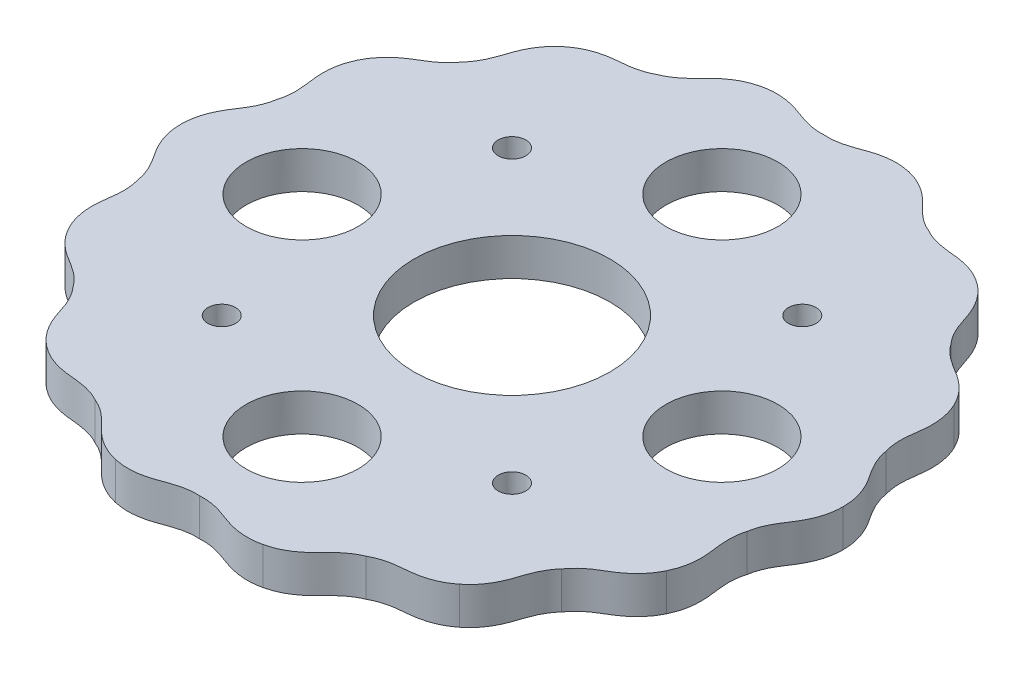
from build123d import *

# Parameters (mm, degrees)
BOSS_EXTRUDE3_DEPTH = 4
SKETCH2_R           = 6
SKETCH2_R_2         = 10.5
CUT_EXTRUDE1_DEPTH  = 5
SKETCH2_4_R         = 1.48
CUT_EXTRUDE2_DEPTH  = 2.22


with BuildPart() as part:
    # Sketch1 → Boss-Extrude3 (new body)
    with BuildSketch(Plane(origin=(0, 0, 0), x_dir=(1, 0, 0), z_dir=(0, 1, 0))):
        with BuildLine():
            Line((35.500002326, 0.003735881), (35.500002326, 0))
            Line((35.500002326, 0), (35.500002326, -0.003735881))
            add(Edge.make_bspline(
                [(32.644810899, -7.45096506), (32.674793712, -7.260710929), (32.757965618, -6.873262555), (32.975088878, -6.197475635), (33.30681421, -5.487322542), (33.693887271, -4.83935734), (34.139372051, -4.165162167), (34.499748971, -3.6014921), (34.870711868, -2.889611748), (35.149566879, -2.192738575), (35.418263863, -1.23361479), (35.50061524, -0.495919336), (35.500002326, -0.003735881)],
                knots=[0.02301065, 0.02301065, 0.02301065, 0.02301065, 0.053541567, 0.084072485, 0.145134319, 0.206196153, 0.267257988, 0.389381656, 0.511505325, 0.633628994, 0.755752663, 1, 1, 1, 1], degree=3))
            add(Edge.make_bspline(
                [(31.986017844, -15.399507835), (32.200120458, -14.956331799), (32.445998494, -14.255960238), (32.62005909, -13.275236314), (32.671181344, -12.526384626), (32.645828632, -11.724047822), (32.565707523, -11.059836954), (32.456861927, -10.25911949), (32.389262714, -9.507378309), (32.398512397, -8.723622254), (32.496104055, -8.020553026), (32.589276306, -7.635387164), (32.644810899, -7.45096506)],
                knots=[0.02301065, 0.02301065, 0.02301065, 0.02301065, 0.267257988, 0.389381656, 0.511505325, 0.633628994, 0.755752663, 0.816814497, 0.877876331, 0.938938166, 0.969469083, 1, 1, 1, 1], degree=3))
            Line((31.986017844, -15.399507835), (31.984396906, -15.402873748))
            Line((31.984396906, -15.402873748), (31.982775968, -15.406239661))
            add(Edge.make_bspline(
                [(26.179105738, -20.877140171), (26.288667493, -20.718736177), (26.531710341, -20.405744191), (27.020544594, -19.891087467), (27.62754267, -19.395191866), (28.257425012, -18.979340099), (28.951315253, -18.565199839), (29.520570914, -18.213712342), (30.163670245, -17.733285076), (30.717271866, -17.226414698), (31.375507699, -16.478857279), (31.769777787, -15.849947564), (31.982775968, -15.406239661)],
                knots=[0.02301065, 0.02301065, 0.02301065, 0.02301065, 0.053541567, 0.084072485, 0.145134319, 0.206196153, 0.267257988, 0.389381656, 0.511505325, 0.633628994, 0.755752663, 1, 1, 1, 1], degree=3))
            add(Edge.make_bspline(
                [(22.136810246, -27.752690162), (22.521996911, -27.446297993), (23.047405198, -26.921967502), (23.62974854, -26.113887841), (24.00072267, -25.461376898), (24.326001557, -24.727496287), (24.542005228, -24.094299727), (24.791357022, -23.325651886), (25.05662051, -22.619026286), (25.405013194, -21.916899767), (25.797990545, -21.325799714), (26.049053047, -21.019203188), (26.179105738, -20.877140171)],
                knots=[0.02301065, 0.02301065, 0.02301065, 0.02301065, 0.267257988, 0.389381656, 0.511505325, 0.633628994, 0.755752663, 0.816814497, 0.877876331, 0.938938166, 0.969469083, 1, 1, 1, 1], degree=3))
            Line((22.136810246, -27.752690162), (22.133889416, -27.755019446))
            Line((22.133889416, -27.755019446), (22.130968587, -27.75734873))
            add(Edge.make_bspline(
                [(14.52830762, -30.168341629), (14.695748267, -30.073161626), (15.05052444, -29.89661793), (15.714250068, -29.645025478), (16.476297475, -29.461605575), (17.224233175, -29.360231784), (18.029095404, -29.288171996), (18.694481743, -29.218483478), (19.482343797, -29.064663811), (20.201044438, -28.848188121), (21.118447439, -28.460259983), (21.746546212, -28.06469929), (22.130968587, -27.75734873)],
                knots=[0.02301065, 0.02301065, 0.02301065, 0.02301065, 0.053541567, 0.084072485, 0.145134319, 0.206196153, 0.267257988, 0.389381656, 0.511505325, 0.633628994, 0.755752663, 1, 1, 1, 1], degree=3))
            add(Edge.make_bspline(
                [(7.903135888, -34.609111839), (8.383115662, -34.500188263), (9.083990645, -34.255748926), (9.959276491, -33.780363616), (10.576626521, -33.353431213), (11.188111536, -32.833360849), (11.657457809, -32.356590942), (12.215619812, -31.772252855), (12.761207314, -31.250698702), (13.379739556, -30.769266488), (13.990268616, -30.407210225), (14.349495361, -30.239908237), (14.52830762, -30.168341629)],
                knots=[0.02301065, 0.02301065, 0.02301065, 0.02301065, 0.267257988, 0.389381656, 0.511505325, 0.633628994, 0.755752663, 0.816814497, 0.877876331, 0.938938166, 0.969469083, 1, 1, 1, 1], degree=3))
            Line((7.903135888, -34.609111839), (7.899493673, -34.60994315))
            Line((7.899493673, -34.60994315), (7.895851458, -34.610774462))
            add(Edge.make_bspline(
                [(0, -33.484333037), (0.192155866, -33.471228592), (0.588397592, -33.466099831), (1.295555593, -33.527402621), (2.061719496, -33.692786976), (2.779570716, -33.925969485), (3.535992098, -34.210262493), (4.165721189, -34.43617562), (4.942300224, -34.639429423), (5.683752409, -34.756224087), (6.678619663, -34.804759157), (7.416144457, -34.72089313), (7.895851458, -34.610774462)],
                knots=[0.02301065, 0.02301065, 0.02301065, 0.02301065, 0.053541567, 0.084072485, 0.145134319, 0.206196153, 0.267257988, 0.389381656, 0.511505325, 0.633628994, 0.755752663, 1, 1, 1, 1], degree=3))
            add(Edge.make_bspline(
                [(-7.895851458, -34.610774462), (-7.416144457, -34.72089313), (-6.678619663, -34.804759157), (-5.683752409, -34.756224087), (-4.942300224, -34.639429423), (-4.165721189, -34.43617562), (-3.535992098, -34.210262493), (-2.779570716, -33.925969485), (-2.061719496, -33.692786976), (-1.295555593, -33.527402621), (-0.588397592, -33.466099831), (-0.192155866, -33.471228592), (0, -33.484333037)],
                knots=[0.02301065, 0.02301065, 0.02301065, 0.02301065, 0.267257988, 0.389381656, 0.511505325, 0.633628994, 0.755752663, 0.816814497, 0.877876331, 0.938938166, 0.969469083, 1, 1, 1, 1], degree=3))
            Line((-7.895851458, -34.610774462), (-7.899493673, -34.60994315))
            Line((-7.899493673, -34.60994315), (-7.903135888, -34.609111839))
            add(Edge.make_bspline(
                [(-14.52830762, -30.168341629), (-14.349495361, -30.239908237), (-13.990268616, -30.407210225), (-13.379739556, -30.769266488), (-12.761207314, -31.250698702), (-12.215619812, -31.772252855), (-11.657457809, -32.356590942), (-11.188111536, -32.833360849), (-10.576626521, -33.353431213), (-9.959276491, -33.780363616), (-9.083990645, -34.255748926), (-8.383115662, -34.500188263), (-7.903135888, -34.609111839)],
                knots=[0.02301065, 0.02301065, 0.02301065, 0.02301065, 0.053541567, 0.084072485, 0.145134319, 0.206196153, 0.267257988, 0.389381656, 0.511505325, 0.633628994, 0.755752663, 1, 1, 1, 1], degree=3))
            add(Edge.make_bspline(
                [(-22.130968587, -27.75734873), (-21.746546212, -28.06469929), (-21.118447439, -28.460259983), (-20.201044438, -28.848188121), (-19.482343797, -29.064663811), (-18.694481743, -29.218483478), (-18.029095404, -29.288171996), (-17.224233175, -29.360231784), (-16.476297475, -29.461605575), (-15.714250068, -29.645025478), (-15.05052444, -29.89661793), (-14.695748267, -30.073161626), (-14.52830762, -30.168341629)],
                knots=[0.02301065, 0.02301065, 0.02301065, 0.02301065, 0.267257988, 0.389381656, 0.511505325, 0.633628994, 0.755752663, 0.816814497, 0.877876331, 0.938938166, 0.969469083, 1, 1, 1, 1], degree=3))
            Line((-22.130968587, -27.75734873), (-22.133889416, -27.755019446))
            Line((-22.133889416, -27.755019446), (-22.136810246, -27.752690162))
            add(Edge.make_bspline(
                [(-26.179105738, -20.877140171), (-26.049053047, -21.019203188), (-25.797990545, -21.325799714), (-25.405013194, -21.916899767), (-25.05662051, -22.619026286), (-24.791357022, -23.325651886), (-24.542005228, -24.094299727), (-24.326001557, -24.727496287), (-24.00072267, -25.461376898), (-23.62974854, -26.113887841), (-23.047405198, -26.921967502), (-22.521996911, -27.446297993), (-22.136810246, -27.752690162)],
                knots=[0.02301065, 0.02301065, 0.02301065, 0.02301065, 0.053541567, 0.084072485, 0.145134319, 0.206196153, 0.267257988, 0.389381656, 0.511505325, 0.633628994, 0.755752663, 1, 1, 1, 1], degree=3))
            add(Edge.make_bspline(
                [(-31.982775968, -15.406239661), (-31.769777787, -15.849947564), (-31.375507698, -16.478857279), (-30.717271866, -17.226414698), (-30.163670245, -17.733285076), (-29.520570914, -18.213712342), (-28.951315253, -18.565199839), (-28.257425012, -18.979340099), (-27.62754267, -19.395191866), (-27.020544594, -19.891087467), (-26.531710341, -20.405744191), (-26.288667493, -20.718736177), (-26.179105738, -20.877140171)],
                knots=[0.02301065, 0.02301065, 0.02301065, 0.02301065, 0.267257988, 0.389381656, 0.511505325, 0.633628994, 0.755752663, 0.816814497, 0.877876331, 0.938938166, 0.969469083, 1, 1, 1, 1], degree=3))
            Line((-31.982775968, -15.406239661), (-31.984396906, -15.402873748))
            Line((-31.984396906, -15.402873748), (-31.986017844, -15.399507835))
            add(Edge.make_bspline(
                [(-32.644810899, -7.45096506), (-32.589276306, -7.635387164), (-32.496104055, -8.020553026), (-32.398512397, -8.723622254), (-32.389262714, -9.507378309), (-32.456861927, -10.25911949), (-32.565707523, -11.059836954), (-32.645828632, -11.724047822), (-32.671181344, -12.526384626), (-32.62005909, -13.275236314), (-32.445998494, -14.255960238), (-32.200120458, -14.956331799), (-31.986017844, -15.399507835)],
                knots=[0.02301065, 0.02301065, 0.02301065, 0.02301065, 0.053541567, 0.084072485, 0.145134319, 0.206196153, 0.267257988, 0.389381656, 0.511505325, 0.633628994, 0.755752663, 1, 1, 1, 1], degree=3))
            add(Edge.make_bspline(
                [(-35.500002326, -0.003735881), (-35.50061524, -0.495919336), (-35.418263863, -1.23361479), (-35.149566879, -2.192738575), (-34.870711868, -2.889611748), (-34.499748971, -3.6014921), (-34.139372051, -4.165162167), (-33.693887271, -4.83935734), (-33.30681421, -5.487322542), (-32.975088878, -6.197475635), (-32.757965618, -6.873262555), (-32.674793712, -7.260710929), (-32.644810899, -7.45096506)],
                knots=[0.02301065, 0.02301065, 0.02301065, 0.02301065, 0.267257988, 0.389381656, 0.511505325, 0.633628994, 0.755752663, 0.816814497, 0.877876331, 0.938938166, 0.969469083, 1, 1, 1, 1], degree=3))
            Line((-35.500002326, -0.003735881), (-35.500002326, 0))
            Line((-35.500002326, 0), (-35.500002326, 0.003735881))
            add(Edge.make_bspline(
                [(-32.644810899, 7.45096506), (-32.674793712, 7.260710929), (-32.757965618, 6.873262555), (-32.975088878, 6.197475635), (-33.30681421, 5.487322542), (-33.693887271, 4.83935734), (-34.139372051, 4.165162167), (-34.499748971, 3.6014921), (-34.870711868, 2.889611748), (-35.149566879, 2.192738575), (-35.418263863, 1.23361479), (-35.50061524, 0.495919336), (-35.500002326, 0.003735881)],
                knots=[0.02301065, 0.02301065, 0.02301065, 0.02301065, 0.053541567, 0.084072485, 0.145134319, 0.206196153, 0.267257988, 0.389381656, 0.511505325, 0.633628994, 0.755752663, 1, 1, 1, 1], degree=3))
            add(Edge.make_bspline(
                [(-31.986017844, 15.399507835), (-32.200120458, 14.956331799), (-32.445998494, 14.255960238), (-32.62005909, 13.275236314), (-32.671181344, 12.526384626), (-32.645828632, 11.724047822), (-32.565707523, 11.059836954), (-32.456861927, 10.25911949), (-32.389262714, 9.507378309), (-32.398512397, 8.723622254), (-32.496104055, 8.020553026), (-32.589276306, 7.635387164), (-32.644810899, 7.45096506)],
                knots=[0.02301065, 0.02301065, 0.02301065, 0.02301065, 0.267257988, 0.389381656, 0.511505325, 0.633628994, 0.755752663, 0.816814497, 0.877876331, 0.938938166, 0.969469083, 1, 1, 1, 1], degree=3))
            Line((-31.986017844, 15.399507835), (-31.984396906, 15.402873748))
            Line((-31.984396906, 15.402873748), (-31.982775968, 15.406239661))
            add(Edge.make_bspline(
                [(-26.179105738, 20.877140171), (-26.288667493, 20.718736177), (-26.531710341, 20.405744191), (-27.020544594, 19.891087467), (-27.62754267, 19.395191866), (-28.257425012, 18.979340099), (-28.951315253, 18.565199839), (-29.520570914, 18.213712342), (-30.163670245, 17.733285076), (-30.717271866, 17.226414698), (-31.375507699, 16.478857278), (-31.769777787, 15.849947564), (-31.982775968, 15.406239661)],
                knots=[0.02301065, 0.02301065, 0.02301065, 0.02301065, 0.053541567, 0.084072485, 0.145134319, 0.206196153, 0.267257988, 0.389381656, 0.511505325, 0.633628994, 0.755752663, 1, 1, 1, 1], degree=3))
            add(Edge.make_bspline(
                [(-22.136810246, 27.752690162), (-22.521996911, 27.446297993), (-23.047405198, 26.921967502), (-23.62974854, 26.113887841), (-24.00072267, 25.461376898), (-24.326001557, 24.727496287), (-24.542005228, 24.094299727), (-24.791357022, 23.325651886), (-25.05662051, 22.619026286), (-25.405013194, 21.916899767), (-25.797990545, 21.325799714), (-26.049053047, 21.019203188), (-26.179105738, 20.877140171)],
                knots=[0.02301065, 0.02301065, 0.02301065, 0.02301065, 0.267257988, 0.389381656, 0.511505325, 0.633628994, 0.755752663, 0.816814497, 0.877876331, 0.938938166, 0.969469083, 1, 1, 1, 1], degree=3))
            Line((-22.136810246, 27.752690162), (-22.133889416, 27.755019446))
            Line((-22.133889416, 27.755019446), (-22.130968587, 27.75734873))
            add(Edge.make_bspline(
                [(-14.52830762, 30.168341629), (-14.695748267, 30.073161626), (-15.05052444, 29.89661793), (-15.714250068, 29.645025478), (-16.476297475, 29.461605575), (-17.224233175, 29.360231784), (-18.029095404, 29.288171996), (-18.694481743, 29.218483478), (-19.482343797, 29.064663811), (-20.201044438, 28.848188121), (-21.118447439, 28.460259983), (-21.746546212, 28.06469929), (-22.130968587, 27.75734873)],
                knots=[0.02301065, 0.02301065, 0.02301065, 0.02301065, 0.053541567, 0.084072485, 0.145134319, 0.206196153, 0.267257988, 0.389381656, 0.511505325, 0.633628994, 0.755752663, 1, 1, 1, 1], degree=3))
            add(Edge.make_bspline(
                [(-7.903135888, 34.609111839), (-8.383115662, 34.500188263), (-9.083990645, 34.255748926), (-9.959276491, 33.780363616), (-10.576626521, 33.353431213), (-11.188111536, 32.833360849), (-11.657457809, 32.356590942), (-12.215619812, 31.772252855), (-12.761207314, 31.250698702), (-13.379739556, 30.769266488), (-13.990268616, 30.407210225), (-14.349495361, 30.239908237), (-14.52830762, 30.168341629)],
                knots=[0.02301065, 0.02301065, 0.02301065, 0.02301065, 0.267257988, 0.389381656, 0.511505325, 0.633628994, 0.755752663, 0.816814497, 0.877876331, 0.938938166, 0.969469083, 1, 1, 1, 1], degree=3))
            Line((-7.903135888, 34.609111839), (-7.899493673, 34.60994315))
            Line((-7.899493673, 34.60994315), (-7.895851458, 34.610774462))
            add(Edge.make_bspline(
                [(0, 33.484333037), (-0.192155866, 33.471228592), (-0.588397592, 33.466099831), (-1.295555593, 33.527402621), (-2.061719496, 33.692786976), (-2.779570716, 33.925969485), (-3.535992098, 34.210262493), (-4.165721189, 34.43617562), (-4.942300224, 34.639429423), (-5.683752409, 34.756224087), (-6.678619663, 34.804759157), (-7.416144457, 34.72089313), (-7.895851458, 34.610774462)],
                knots=[0.02301065, 0.02301065, 0.02301065, 0.02301065, 0.053541567, 0.084072485, 0.145134319, 0.206196153, 0.267257988, 0.389381656, 0.511505325, 0.633628994, 0.755752663, 1, 1, 1, 1], degree=3))
            add(Edge.make_bspline(
                [(7.895851458, 34.610774462), (7.416144457, 34.72089313), (6.678619663, 34.804759157), (5.683752409, 34.756224087), (4.942300224, 34.639429423), (4.165721189, 34.43617562), (3.535992098, 34.210262493), (2.779570716, 33.925969485), (2.061719496, 33.692786976), (1.295555593, 33.527402621), (0.588397592, 33.466099831), (0.192155866, 33.471228592), (0, 33.484333037)],
                knots=[0.02301065, 0.02301065, 0.02301065, 0.02301065, 0.267257988, 0.389381656, 0.511505325, 0.633628994, 0.755752663, 0.816814497, 0.877876331, 0.938938166, 0.969469083, 1, 1, 1, 1], degree=3))
            Line((7.895851458, 34.610774462), (7.899493673, 34.60994315))
            Line((7.899493673, 34.60994315), (7.903135888, 34.609111839))
            add(Edge.make_bspline(
                [(14.52830762, 30.168341629), (14.349495361, 30.239908237), (13.990268616, 30.407210225), (13.379739556, 30.769266488), (12.761207314, 31.250698702), (12.215619812, 31.772252855), (11.657457809, 32.356590942), (11.188111536, 32.833360849), (10.576626521, 33.353431213), (9.959276491, 33.780363616), (9.083990645, 34.255748926), (8.383115662, 34.500188263), (7.903135888, 34.609111839)],
                knots=[0.02301065, 0.02301065, 0.02301065, 0.02301065, 0.053541567, 0.084072485, 0.145134319, 0.206196153, 0.267257988, 0.389381656, 0.511505325, 0.633628994, 0.755752663, 1, 1, 1, 1], degree=3))
            add(Edge.make_bspline(
                [(22.130968587, 27.75734873), (21.746546212, 28.06469929), (21.118447439, 28.460259983), (20.201044438, 28.848188121), (19.482343797, 29.064663811), (18.694481743, 29.218483478), (18.029095404, 29.288171996), (17.224233175, 29.360231784), (16.476297475, 29.461605575), (15.714250068, 29.645025478), (15.05052444, 29.89661793), (14.695748267, 30.073161626), (14.52830762, 30.168341629)],
                knots=[0.02301065, 0.02301065, 0.02301065, 0.02301065, 0.267257988, 0.389381656, 0.511505325, 0.633628994, 0.755752663, 0.816814497, 0.877876331, 0.938938166, 0.969469083, 1, 1, 1, 1], degree=3))
            Line((22.130968587, 27.75734873), (22.133889416, 27.755019446))
            Line((22.133889416, 27.755019446), (22.136810246, 27.752690162))
            add(Edge.make_bspline(
                [(26.179105738, 20.877140171), (26.049053047, 21.019203188), (25.797990545, 21.325799714), (25.405013194, 21.916899767), (25.05662051, 22.619026286), (24.791357022, 23.325651886), (24.542005228, 24.094299727), (24.326001557, 24.727496287), (24.00072267, 25.461376898), (23.62974854, 26.113887841), (23.047405198, 26.921967502), (22.521996911, 27.446297993), (22.136810246, 27.752690162)],
                knots=[0.02301065, 0.02301065, 0.02301065, 0.02301065, 0.053541567, 0.084072485, 0.145134319, 0.206196153, 0.267257988, 0.389381656, 0.511505325, 0.633628994, 0.755752663, 1, 1, 1, 1], degree=3))
            add(Edge.make_bspline(
                [(31.982775968, 15.406239661), (31.769777787, 15.849947564), (31.375507698, 16.478857279), (30.717271866, 17.226414698), (30.163670245, 17.733285076), (29.520570914, 18.213712342), (28.951315253, 18.565199839), (28.257425012, 18.979340099), (27.62754267, 19.395191866), (27.020544594, 19.891087467), (26.531710341, 20.405744191), (26.288667493, 20.718736177), (26.179105738, 20.877140171)],
                knots=[0.02301065, 0.02301065, 0.02301065, 0.02301065, 0.267257988, 0.389381656, 0.511505325, 0.633628994, 0.755752663, 0.816814497, 0.877876331, 0.938938166, 0.969469083, 1, 1, 1, 1], degree=3))
            Line((31.982775968, 15.406239661), (31.984396906, 15.402873748))
            Line((31.984396906, 15.402873748), (31.986017844, 15.399507835))
            add(Edge.make_bspline(
                [(32.644810899, 7.45096506), (32.589276306, 7.635387164), (32.496104055, 8.020553026), (32.398512397, 8.723622254), (32.389262714, 9.507378309), (32.456861927, 10.25911949), (32.565707523, 11.059836954), (32.645828632, 11.724047822), (32.671181344, 12.526384626), (32.62005909, 13.275236314), (32.445998494, 14.255960238), (32.200120458, 14.956331799), (31.986017844, 15.399507835)],
                knots=[0.02301065, 0.02301065, 0.02301065, 0.02301065, 0.053541567, 0.084072485, 0.145134319, 0.206196153, 0.267257988, 0.389381656, 0.511505325, 0.633628994, 0.755752663, 1, 1, 1, 1], degree=3))
            add(Edge.make_bspline(
                [(35.500002326, 0.003735881), (35.50061524, 0.495919336), (35.418263863, 1.23361479), (35.149566879, 2.192738575), (34.870711868, 2.889611748), (34.499748971, 3.6014921), (34.139372051, 4.165162167), (33.693887271, 4.83935734), (33.30681421, 5.487322542), (32.975088878, 6.197475635), (32.757965618, 6.873262555), (32.674793712, 7.260710929), (32.644810899, 7.45096506)],
                knots=[0.02301065, 0.02301065, 0.02301065, 0.02301065, 0.267257988, 0.389381656, 0.511505325, 0.633628994, 0.755752663, 0.816814497, 0.877876331, 0.938938166, 0.969469083, 1, 1, 1, 1], degree=3))
        make_face()
    extrude(amount=BOSS_EXTRUDE3_DEPTH)

    # Sketch2 → Cut-Extrude1 (cut)
    with BuildSketch(Plane(origin=(0, 4, 0), x_dir=(1, 0, 0), z_dir=(0, 1, 0))):
        with Locations((22.5, 0)):
            Circle(SKETCH2_R)
        Circle(SKETCH2_R_2)
        with Locations((0, -22.5)):
            Circle(SKETCH2_R)
        with Locations((-22.5, 0)):
            Circle(SKETCH2_R)
        with Locations((0, 22.5)):
            Circle(SKETCH2_R)
    extrude(amount=-CUT_EXTRUDE1_DEPTH, mode=Mode.SUBTRACT)

    # Sketch2<4> → Cut-Extrude2 (cut)
    with BuildSketch(Plane(origin=(0, 4, 0), x_dir=(1, 0, 0), z_dir=(0, 1, 0))):
        with Locations((15.556349186, 15.556349186)):
            Circle(SKETCH2_4_R)
        with Locations((15.556349186, -15.556349186)):
            Circle(SKETCH2_4_R)
        with Locations((-15.556349186, -15.556349186)):
            Circle(SKETCH2_4_R)
        with Locations((-15.556349186, 15.556349186)):
            Circle(SKETCH2_4_R)
    extrude(amount=-CUT_EXTRUDE2_DEPTH, mode=Mode.SUBTRACT)


solid = part.part
